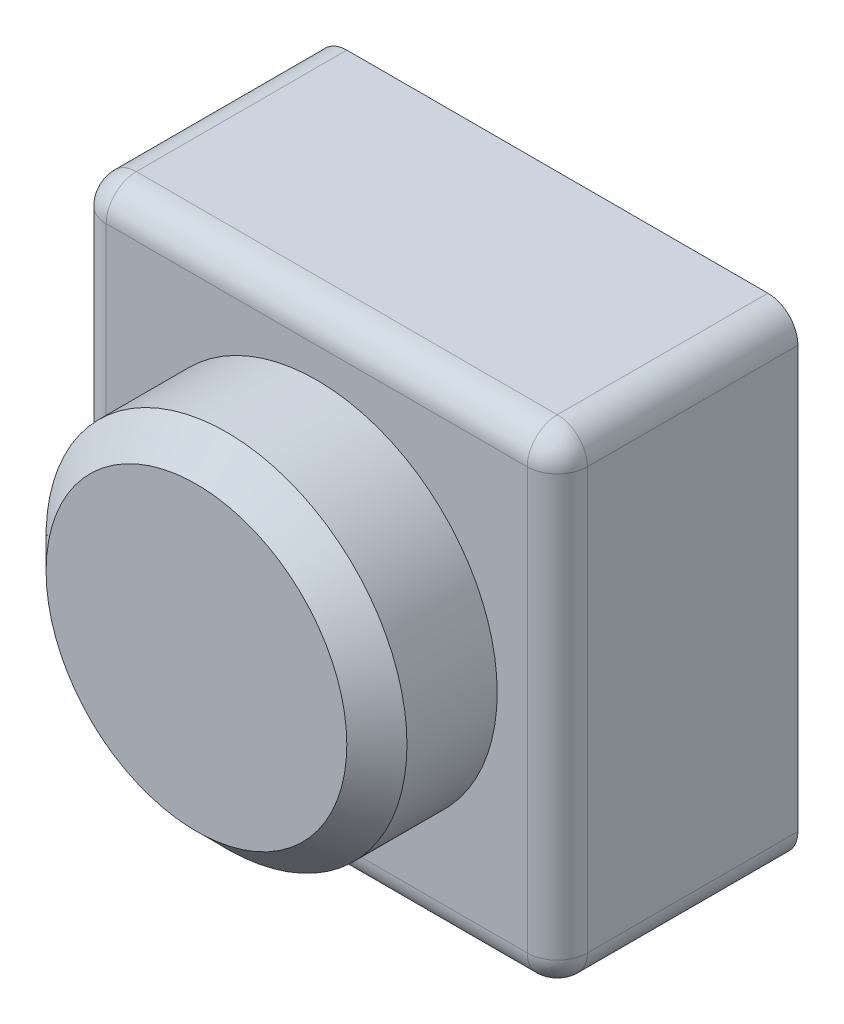
from build123d import *

# Parameters (mm, degrees)
SKETCH_1_W          = 80
SKETCH_1_H          = 80
EXTRUDE_1_DEPTH     = 40
SKETCH_2_R          = 30
EXTRUDE_2_DEPTH     = 20
SKETCH_3_W          = 60
SKETCH_3_H          = 60
CUT_EXTRUDE_1_DEPTH = 30
SKETCH_4_R          = 20
CUT_EXTRUDE_2_DEPTH = 20
CHAMFER_1_SIZE      = 5
FILLET_1_R          = 5


with BuildPart() as part:
    # 草图1 → 凸台-拉伸1 (new body)
    with BuildSketch(Plane.XY):
        Rectangle(SKETCH_1_W, SKETCH_1_H)
    extrude(amount=EXTRUDE_1_DEPTH)

    # 草图2 → 凸台-拉伸2 (add)
    with BuildSketch(Plane.XY.offset(40)):
        Circle(SKETCH_2_R)
    extrude(amount=EXTRUDE_2_DEPTH)

    # 草图3 → 切除-拉伸1 (cut)
    with BuildSketch(Plane(origin=(0, 0, 0), x_dir=(-1, 0, 0), z_dir=(0, 0, -1))):
        Rectangle(SKETCH_3_W, SKETCH_3_H)
    extrude(amount=-CUT_EXTRUDE_1_DEPTH, mode=Mode.SUBTRACT)

    # 草图4 → 切除-拉伸2 (cut)
    with BuildSketch(Plane(origin=(0, 0, 30), x_dir=(-1, 0, 0), z_dir=(0, 0, -1))):
        Circle(SKETCH_4_R)
    extrude(amount=-CUT_EXTRUDE_2_DEPTH, mode=Mode.SUBTRACT)

    # 倒角1
    chamfer_1_edges = [part.edges().sort_by_distance(p)[0] for p in [
        (-30, 0, 60),
    ]]
    chamfer(chamfer_1_edges, length=CHAMFER_1_SIZE)

    # 圆角1
    fillet_1_edges = [part.edges().sort_by_distance(p)[0] for p in [
        (-40, 0, 40),
        (0, -40, 40),
        (40, 0, 40),
        (40, -40, 20),
        (-40, -40, 20),
        (-40, 40, 20),
        (40, 40, 20),
        (0, 40, 40),
    ]]
    fillet(fillet_1_edges, radius=FILLET_1_R)


solid = part.part
